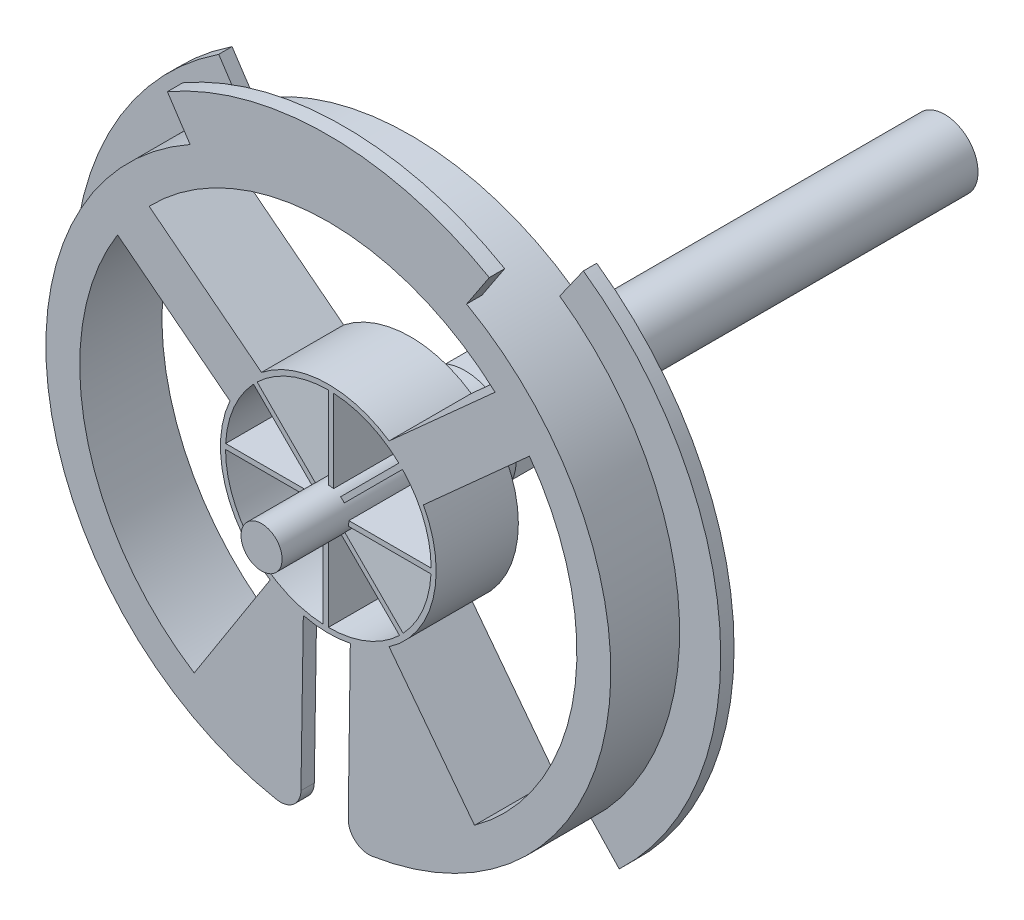
from build123d import *

# Parameters (mm, degrees)
CROQUIS1_R                 = 31.5
SALIENTE_EXTRUIR1_DEPTH    = 8
CORTAR_EXTRUIR2_START      = -6.7
CROQUIS2_R                 = 31.5
CROQUIS2_R_2               = 27.5
CORTAR_EXTRUIR2_DEPTH      = 6.7
CORTAR_EXTRUIR4_DEPTH      = 46.260357931
CORTAR_EXTRUIR5_DEPTH      = 46.260357931
CORTAR_EXTRUIR6_DEPTH      = 46.04875137
CORTAR_EXTRUIR7_DEPTH      = 46.04875137
CORTAR_EXTRUIR8_START      = -6.7
CORTAR_EXTRUIR8_DEPTH      = 6.7
REDONDEO1_R                = 2
SALIENTE_EXTRUIR2_DEPTH    = 1.5
CORTAR_EXTRUIR9_DEPTH      = 46.260357931
CORTAR_EXTRUIR9_DEPTH_BACK = 7
CROQUIS9_R                 = 2
SALIENTE_EXTRUIR3_DEPTH    = 6.5
CROQUIS10_R                = 5
CROQUIS10_W                = 6.5
CROQUIS10_H                = 6.5
SALIENTE_EXTRUIR5_DEPTH    = 5.3
CROQUIS10_3_W              = 6.5
CROQUIS10_3_H              = 6.5
SALIENTE_EXTRUIR6_DEPTH    = 15
CROQUIS11_R                = 3.25
SALIENTE_EXTRUIR7_DEPTH    = 37


with BuildPart() as part:
    # Croquis1 → Saliente-Extruir1 (new body)
    with BuildSketch(Plane.XY):
        Circle(CROQUIS1_R)
    extrude(amount=SALIENTE_EXTRUIR1_DEPTH)

    # Croquis2 → Cortar-Extruir2 (cut)
    with BuildSketch(Plane.XY.offset(8).offset(CORTAR_EXTRUIR2_START)):
        Circle(CROQUIS2_R)
        Circle(CROQUIS2_R_2, mode=Mode.SUBTRACT)
    extrude(amount=CORTAR_EXTRUIR2_DEPTH, mode=Mode.SUBTRACT)

    # Croquis3 → Cortar-Extruir4 (cut, through all)
    with BuildSketch(Plane.XY.offset(8)):
        with BuildLine():
            Line((-9.579379365, 4.299475663), (-20.51909885, 12.829909679))
            ThreePointArc((-20.51909885, 12.829909679), (-23.611186728, -5.305832762), (-13.057369721, -20.375109717))
            Line((-13.057369721, -20.375109717), (-5.665387689, -8.840440166))
            ThreePointArc((-5.665387689, -8.840440166), (-10.063055085, -2.997486008), (-9.579379365, 4.299475663))
        make_face()
        with BuildLine():
            ThreePointArc((16.237061362, 17.944298212), (-0.84115789, 24.185376851), (-17.444510686, 16.77286639))
            Line((-17.444510686, 16.77286639), (-6.504791201, 8.242432373))
            ThreePointArc((-6.504791201, 8.242432373), (-0.3649652, 10.493655245), (5.916429122, 8.674437529))
            Line((5.916429122, 8.674437529), (16.237061362, 17.944298212))
        make_face()
        with BuildLine():
            ThreePointArc((14.229512126, -19.574498325), (23.902558724, -3.782550254), (19.578157945, 14.224476493))
            Line((19.578157945, 14.224476493), (9.257525705, 4.954615809))
            ThreePointArc((9.257525705, 4.954615809), (10.197616725, -2.501722034), (5.913499206, -8.676435163))
            Line((5.913499206, -8.676435163), (14.229512126, -19.574498325))
        make_face()
    extrude(amount=-CORTAR_EXTRUIR4_DEPTH, mode=Mode.SUBTRACT)

    # Croquis3<4> → Cortar-Extruir5 (cut, through all)
    with BuildSketch(Plane.XY.offset(8)):
        with BuildLine():
            ThreePointArc((-2.701947276, -27.366941388), (-0.398068092, -27.497118791), (1.908613915, -27.433687192))
            Line((1.908613915, -27.433687192), (2.138825202, -10.279855386))
            ThreePointArc((2.138825202, -10.279855386), (-0.151989635, -10.498899902), (-2.435503713, -10.213634107))
            Line((-2.435503713, -10.213634107), (-2.701947276, -27.366941388))
        make_face()
    extrude(amount=-CORTAR_EXTRUIR5_DEPTH, mode=Mode.SUBTRACT)

    # Croquis4 → Cortar-Extruir6 (cut, through all)
    with BuildSketch(Plane.XY.offset(1.3)):
        Polygon((-2.701947276, -27.366941388), (1.908613915, -27.433687192), (1.818382526, -33.666548493), (-2.792178664, -33.599802689), align=None)
    extrude(amount=-CORTAR_EXTRUIR6_DEPTH, mode=Mode.SUBTRACT)

    # Croquis5 → Cortar-Extruir7 (cut, through all)
    with BuildSketch(Plane.XY.offset(1.3)):
        with BuildLine():
            Line((15.824611578, 22.490701821), (18.126373262, 25.762076631))
            ThreePointArc((18.126373262, 25.762076631), (0.455968906, 31.496699706), (-17.373032714, 26.275991595))
            Line((-17.373032714, 26.275991595), (-15.166933322, 22.939357742))
            ThreePointArc((-15.166933322, 22.939357742), (0.398068092, 27.497118791), (15.824611578, 22.490701821))
        make_face()
        with BuildLine():
            Line((21.619759605, -22.909299305), (18.874393306, -20.000181933))
            ThreePointArc((18.874393306, -20.000181933), (11.036194878, -25.188338623), (1.908613915, -27.433687192))
            Line((1.908613915, -27.433687192), (1.850534631, -31.445596219))
            ThreePointArc((1.850534631, -31.445596219), (12.487224236, -28.919184478), (21.619759605, -22.909299305))
        make_face()
        with BuildLine():
            ThreePointArc((-2.701947276, -27.366941388), (-11.760706264, -24.858314267), (-19.445436483, -19.445436483))
            Line((-19.445436483, -19.445436483), (-22.273863607, -22.273863607))
            ThreePointArc((-22.273863607, -22.273863607), (-13.319125738, -28.545593173), (-2.76002656, -31.378850415))
            Line((-2.76002656, -31.378850415), (-2.701947276, -27.366941388))
        make_face()
    extrude(amount=-CORTAR_EXTRUIR7_DEPTH, mode=Mode.SUBTRACT)

    # Croquis6 → Cortar-Extruir8 (cut)
    with BuildSketch(Plane(origin=(0, 0, 0), x_dir=(-1, 0, 0), z_dir=(0, 0, -1)).offset(CORTAR_EXTRUIR8_START)):
        with BuildLine():
            Line((-4.293632906, -9.581999607), (-14.711263483, -23.234214571))
            ThreePointArc((-14.711263483, -23.234214571), (-0.92900238, -27.484303786), (13.108789939, -24.174565691))
            Line((13.108789939, -24.174565691), (3.871385851, -9.760244443))
            ThreePointArc((3.871385851, -9.760244443), (-0.229163587, -10.497498943), (-4.293632906, -9.581999607))
        make_face()
    extrude(amount=CORTAR_EXTRUIR8_DEPTH, mode=Mode.SUBTRACT)

    # Redondeo1
    redondeo1_edges = [part.edges().sort_by_distance(p)[0] for p in [
        (1.908613915, -27.433687192, 7.35),
        (-2.701947276, -27.366941388, 7.35),
    ]]
    fillet(redondeo1_edges, radius=REDONDEO1_R)

    # Croquis7 → Saliente-Extruir2 (add)
    with BuildSketch(Plane.XY.offset(8)):
        with BuildLine():
            Line((-15.669662975, 27.326025365), (-13.458452317, 23.981660935))
            ThreePointArc((-13.458452317, 23.981660935), (0, 27.5), (13.458452317, 23.981660935))
            Line((13.458452317, 23.981660935), (15.669662975, 27.326025365))
            ThreePointArc((15.669662975, 27.326025365), (0, 31.5), (-15.669662975, 27.326025365))
        make_face()
    extrude(amount=-SALIENTE_EXTRUIR2_DEPTH)

    # Croquis8 → Cortar-Extruir9 (cut, two sides: drawn at the far end of the back side and taken through both)
    with BuildSketch(Plane.XY.offset(8).offset(-CORTAR_EXTRUIR9_DEPTH_BACK)):
        with BuildLine():
            ThreePointArc((-1.260412408, 1.552855615), (-0.668688556, 1.884902017), (0, 2))
            Line((0, 2), (0, 10.00738946))
            ThreePointArc((0, 10.00738946), (-3.733928755, 9.284698157), (-6.928560453, 7.22100366))
            Line((-6.928560453, 7.22100366), (-1.260412408, 1.552855615))
        make_face()
        with BuildLine():
            Line((0.5, 9.994890885), (0.5, 1.936491673))
            ThreePointArc((0.5, 1.936491673), (0.861766275, 1.804815472), (1.19160121, 1.606264784))
            Line((1.19160121, 1.606264784), (6.865923152, 7.280586726))
            ThreePointArc((6.865923152, 7.280586726), (3.925056399, 9.205529646), (0.5, 9.994890885))
        make_face()
        with BuildLine():
            ThreePointArc((-1.936491673, 0.5), (-1.804815472, 0.861766275), (-1.606264784, 1.19160121))
            Line((-1.606264784, 1.19160121), (-7.280586726, 6.865923152))
            ThreePointArc((-7.280586726, 6.865923152), (-9.205529646, 3.925056399), (-9.994890885, 0.5))
            Line((-9.994890885, 0.5), (-1.936491673, 0.5))
        make_face()
        with BuildLine():
            Line((7.22100366, 6.928560453), (1.552855615, 1.260412408))
            ThreePointArc((1.552855615, 1.260412408), (1.884902017, 0.668688556), (2, 0))
            Line((2, 0), (10.00738946, 0))
            ThreePointArc((10.00738946, 0), (9.284698157, 3.733928755), (7.22100366, 6.928560453))
        make_face()
        with BuildLine():
            ThreePointArc((-1.552855615, -1.260412408), (-1.884902017, -0.668688556), (-2, 0))
            Line((-2, 0), (-10.00738946, 0))
            ThreePointArc((-10.00738946, 0), (-9.284698157, -3.733928755), (-7.22100366, -6.928560453))
            Line((-7.22100366, -6.928560453), (-1.552855615, -1.260412408))
        make_face()
        with BuildLine():
            Line((9.994890885, -0.5), (1.936491673, -0.5))
            ThreePointArc((1.936491673, -0.5), (1.804815472, -0.861766275), (1.606264784, -1.19160121))
            Line((1.606264784, -1.19160121), (7.280586726, -6.865923152))
            ThreePointArc((7.280586726, -6.865923152), (9.205529646, -3.925056399), (9.994890885, -0.5))
        make_face()
        with BuildLine():
            ThreePointArc((-0.5, -1.936491673), (-0.861766275, -1.804815472), (-1.19160121, -1.606264784))
            Line((-1.19160121, -1.606264784), (-6.865923152, -7.280586726))
            ThreePointArc((-6.865923152, -7.280586726), (-3.925056399, -9.205529646), (-0.5, -9.994890885))
            Line((-0.5, -9.994890885), (-0.5, -1.936491673))
        make_face()
        with BuildLine():
            Line((6.928560453, -7.22100366), (1.260412408, -1.552855615))
            ThreePointArc((1.260412408, -1.552855615), (0.668688556, -1.884902017), (0, -2))
            Line((0, -2), (0, -10.00738946))
            ThreePointArc((0, -10.00738946), (3.733928755, -9.284698157), (6.928560453, -7.22100366))
        make_face()
    extrude(amount=CORTAR_EXTRUIR9_DEPTH + CORTAR_EXTRUIR9_DEPTH_BACK, mode=Mode.SUBTRACT)

    # Croquis9 → Saliente-Extruir3 (add)
    with BuildSketch(Plane.XY.offset(8)):
        Circle(CROQUIS9_R)
    extrude(amount=SALIENTE_EXTRUIR3_DEPTH)

    # Croquis10 → Saliente-Extruir5 (add)
    with BuildSketch(Plane(origin=(0, 0, 0), x_dir=(-1, 0, 0), z_dir=(0, 0, -1))):
        Circle(CROQUIS10_R)
        Rectangle(CROQUIS10_W, CROQUIS10_H, mode=Mode.SUBTRACT)
    extrude(amount=SALIENTE_EXTRUIR5_DEPTH)

    # Croquis10<3> → Saliente-Extruir6 (add)
    with BuildSketch(Plane(origin=(0, 0, 0), x_dir=(-1, 0, 0), z_dir=(0, 0, -1))):
        Rectangle(CROQUIS10_3_W, CROQUIS10_3_H)
    extrude(amount=SALIENTE_EXTRUIR6_DEPTH)

    # Croquis11 → Saliente-Extruir7 (add)
    with BuildSketch(Plane(origin=(0, 0, -15), x_dir=(-1, 0, 0), z_dir=(0, 0, -1))):
        Circle(CROQUIS11_R)
    extrude(amount=SALIENTE_EXTRUIR7_DEPTH)


solid = part.part
